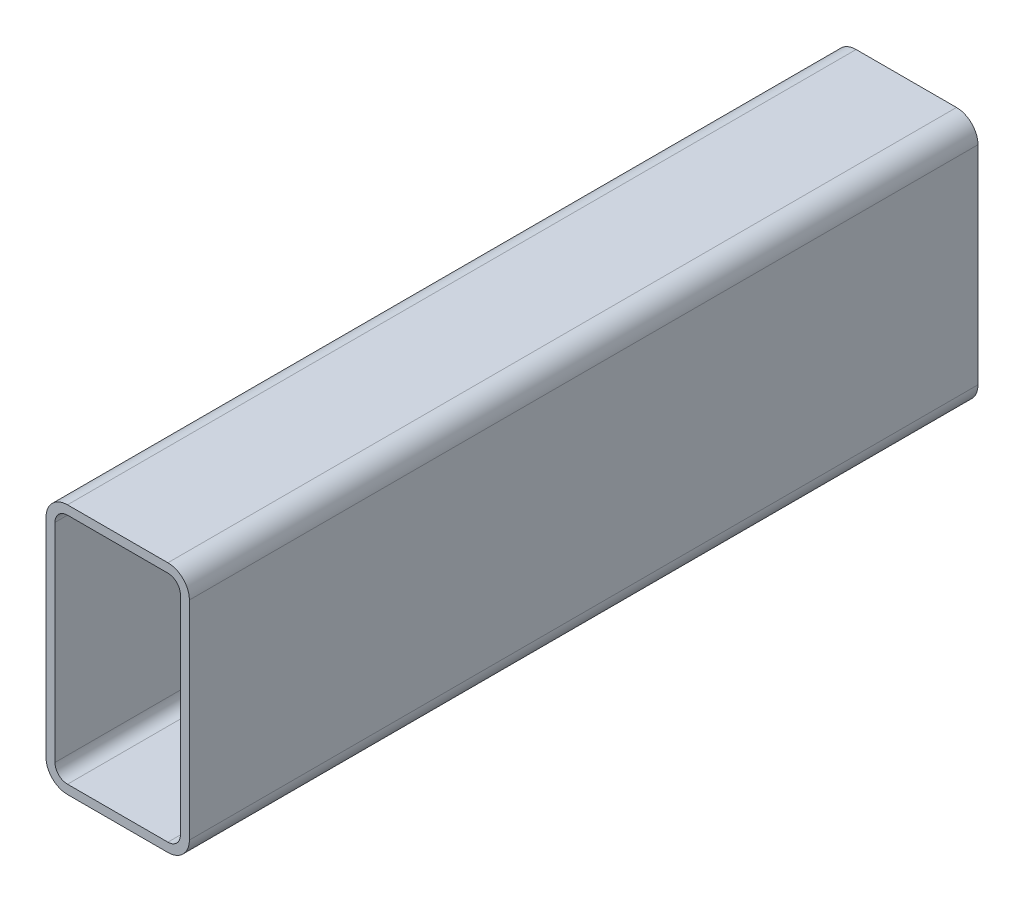
from build123d import *

# Parameters (mm, degrees)
DODANIE_WYCI_GNI_CIE1_DEPTH = 440


with BuildPart() as part:
    # Szkic2 → Dodanie-wyciągnięcie1 (new body)
    with BuildSketch(Plane.XY):
        with BuildLine():
            Line((12, 450), (68, 450))
            ThreePointArc((68, 450), (76.485281374, 446.485281374), (80, 438))
            Line((80, 438), (80, 322))
            ThreePointArc((80, 322), (76.485281374, 313.514718626), (68, 310))
            Line((68, 310), (12, 310))
            ThreePointArc((12, 310), (3.514718626, 313.514718626), (0, 322))
            Line((0, 322), (0, 438))
            ThreePointArc((0, 438), (3.514718626, 446.485281374), (12, 450))
        make_face()
        with BuildLine():
            Line((12, 445), (68, 445))
            ThreePointArc((68, 445), (72.949747468, 442.949747468), (75, 438))
            Line((75, 438), (75, 322))
            ThreePointArc((75, 322), (72.949747468, 317.050252532), (68, 315))
            Line((68, 315), (12, 315))
            ThreePointArc((12, 315), (7.050252532, 317.050252532), (5, 322))
            Line((5, 322), (5, 438))
            ThreePointArc((5, 438), (7.050252532, 442.949747468), (12, 445))
        make_face(mode=Mode.SUBTRACT)
    extrude(amount=DODANIE_WYCI_GNI_CIE1_DEPTH)


solid = part.part
